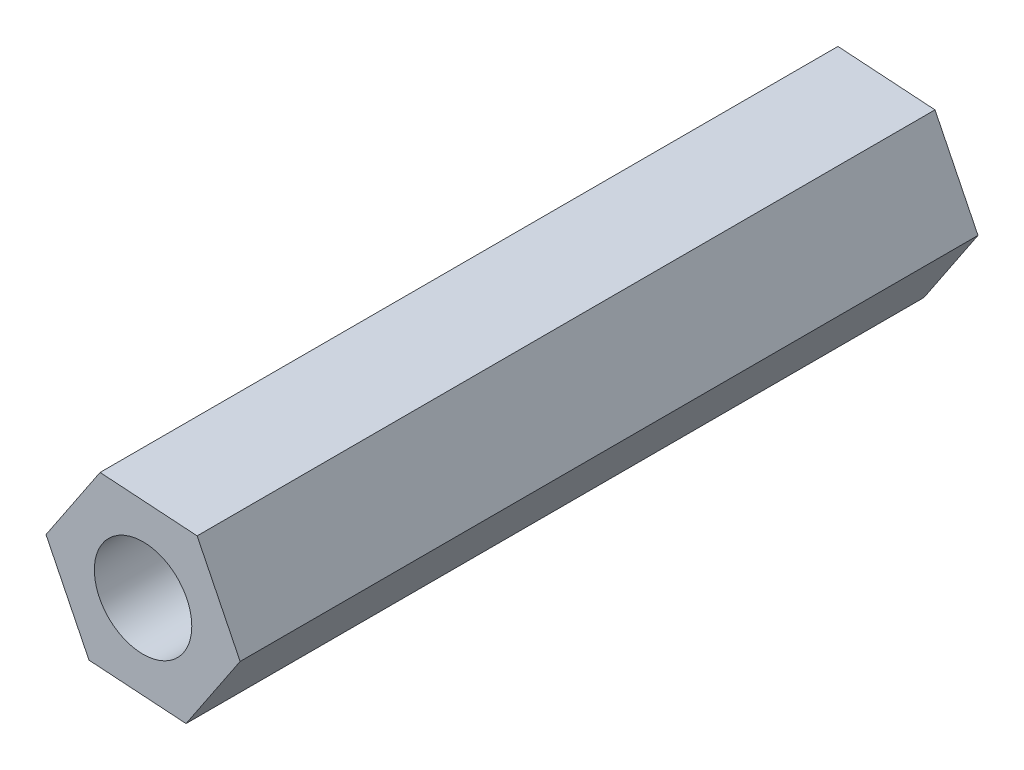
from build123d import *

# Parameters (mm, degrees)
SKETCH1_R           = 1.651
BOSS_EXTRUDE1_DEPTH = 25


with BuildPart() as part:
    # Sketch1 → Boss-Extrude1 (new body)
    with BuildSketch(Plane.XY):
        Polygon((631.983625936, -1285.334286576), (630.151555946, -1288.073859365), (631.608060583, -1291.030264913), (634.896635209, -1291.247097671), (636.728705199, -1288.507524881), (635.272200562, -1285.551119334), align=None)
        with Locations((633.440130573, -1288.290692123)):
            Circle(SKETCH1_R, mode=Mode.SUBTRACT)
    extrude(amount=BOSS_EXTRUDE1_DEPTH)


solid = part.part
